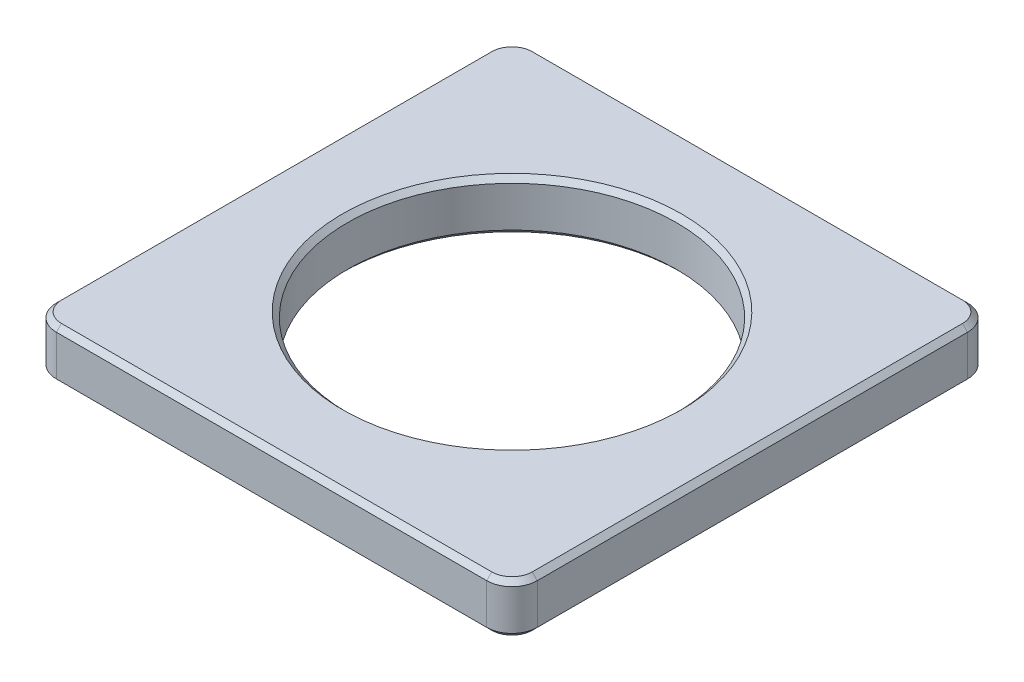
from build123d import *

# Parameters (mm, degrees)
SKETCH1_W           = 95
SKETCH1_H           = 95
SKETCH1_R           = 32.5
BOSS_EXTRUDE1_DEPTH = 10
FILLET1_R           = 5
CHAMFER1_SIZE       = 1


with BuildPart() as part:
    # Sketch1 → Boss-Extrude1 (new body)
    with BuildSketch(Plane(origin=(0, 0, 0), x_dir=(1, 0, 0), z_dir=(0, 1, 0))):
        Rectangle(SKETCH1_W, SKETCH1_H)
        with Locations(Location((0, 0, 0), (0, 0, 270))):
            Circle(SKETCH1_R, mode=Mode.SUBTRACT)
    extrude(amount=BOSS_EXTRUDE1_DEPTH)

    # Fillet1
    fillet1_edges = [part.edges().sort_by_distance(p)[0] for p in [
        (47.5, 5, 47.5),
        (-47.5, 5, 47.5),
        (-47.5, 5, -47.5),
        (47.5, 5, -47.5),
    ]]
    fillet(fillet1_edges, radius=FILLET1_R)

    # Chamfer1
    chamfer1_edges = [part.edges().sort_by_distance(p)[0] for p in [
        (0, 0, -32.5),
        (0, 10, -32.5),
        (-47.5, 0, 0),
        (-47.5, 10, 0),
        (47.5, 0, 0),
        (0, 0, 47.5),
        (0, 0, -47.5),
        (-46.035533906, 0, 46.035533906),
        (46.035533906, 0, 46.035533906),
        (46.035533906, 0, -46.035533906),
        (-46.035533906, 0, -46.035533906),
        (0, 10, -47.5),
        (47.5, 10, 0),
        (0, 10, 47.5),
        (-46.035533906, 10, 46.035533906),
        (46.035533906, 10, 46.035533906),
        (46.035533906, 10, -46.035533906),
        (-46.035533906, 10, -46.035533906),
    ]]
    chamfer(chamfer1_edges, length=CHAMFER1_SIZE)


solid = part.part
